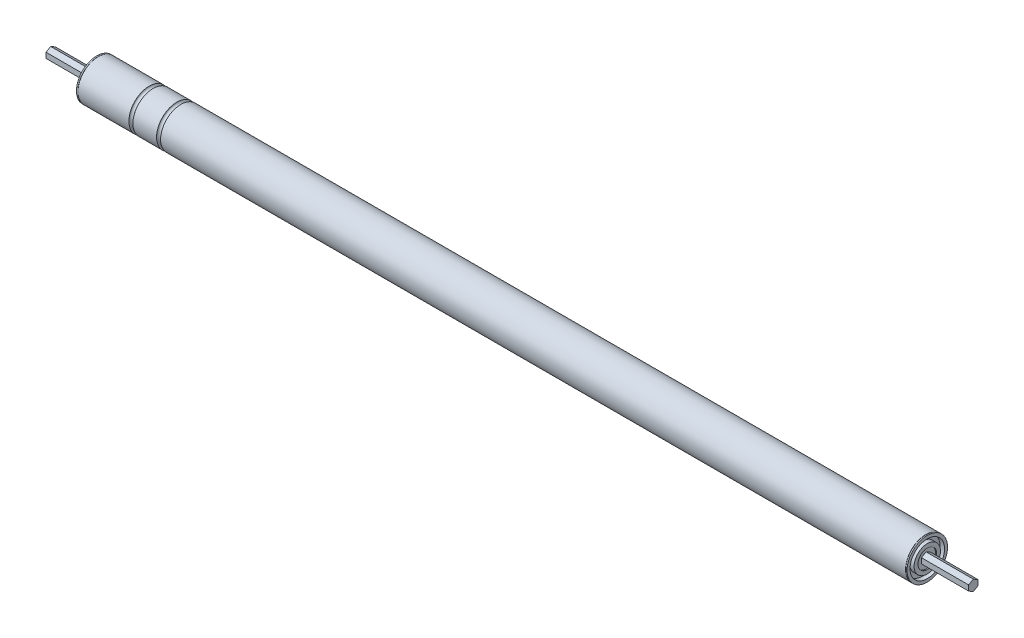
from build123d import *

# Parameters (mm, degrees)
BOSS_EXTRUDE1_START             = -487.984875
SKETCH3_R                       = 24.13
BOSS_EXTRUDE1_DEPTH             = 975.96975
CHAMFER1_SIZE                   = 0.254
BOSS_EXTRUDE3_REACH             = 985.674
SKETCH6_R                       = 24.13
SKETCH6_R_2                     = 22.352
BOSS_EXTRUDE3_DIRECTION_2_REACH = 985.674
BOSS_EXTRUDE2_DEPTH             = 508
BOSS_EXTRUDE2_DEPTH_BACK        = 508
LPATTERN1_COUNT                 = 2
LPATTERN1_PITCH                 = 33.02
BOSS_EXTRUDE4_DEPTH             = 550
BOSS_EXTRUDE5_DEPTH             = 550


with BuildPart() as part:
    # Sketch2 → Revolve1 (revolve)
    with BuildSketch(Plane.XY, mode=Mode.PRIVATE) as revolve1_sk:
        Polygon((-493.7125, 0), (-493.7125, 11.1125), (-495.096875, 11.1125), (-495.096875, 15.712927565), (-489.762875, 15.712927565), (-489.762875, 20.574), (-495.096875, 20.574), (-495.096875, 24.13), (-493.318875, 24.13), (-493.318875, 22.352), (-487.984875, 22.352), (-487.984875, 0), align=None)
    revolve(revolve1_sk.sketch.rotate(Axis((-493.7125, 0, 0), (1, 0, 0)), 180), axis=Axis((-493.7125, 0, 0), (1, 0, 0)))


with BuildPart() as body_2:
    # Mirror2: mirrored copy
    add(part.part.mirror(Plane(origin=(0, 0, 0), x_dir=(0, 0, 1), z_dir=(1, 0, 0))))


with BuildPart() as part_1:
    add(part.part)

    add(body_2.part)  # Boss-Extrude1 merges body 2
    # Sketch3 → Boss-Extrude1 (add)
    with BuildSketch(Plane(origin=(0, 0, 0), x_dir=(0, 0, -1), z_dir=(1, 0, 0)).offset(BOSS_EXTRUDE1_START)):
        with Locations(Location((0, 0, 0), (0, 0, 270))):
            Circle(SKETCH3_R)
    extrude(amount=BOSS_EXTRUDE1_DEPTH)

    # Chamfer1
    chamfer1_edges = [part_1.edges().sort_by_distance(p)[0] for p in [
        (493.318875, 24.13, 0),
        (-493.318875, 24.13, 0),
    ]]
    chamfer(chamfer1_edges, length=CHAMFER1_SIZE)

    # Boss-Extrude3: up to this face of the body (flat: up to its plane)
    boss_extrude3_end = Plane(part_1.part.faces().sort_by_distance((-493.318875, 23.20068474, 0))[0])
    # Sketch6 → Boss-Extrude3 (add, up to the picked face)
    with BuildSketch(Plane.ZY.offset(487.984875), mode=Mode.PRIVATE) as boss_extrude3_sk1:
        with Locations(Location((0, 0, 0), (0, 0, 270))):
            Circle(SKETCH6_R)
        Circle(SKETCH6_R_2, mode=Mode.SUBTRACT)
    boss_extrude3_tool1 = split(extrude(boss_extrude3_sk1.sketch, amount=BOSS_EXTRUDE3_REACH, mode=Mode.PRIVATE), bisect_by=boss_extrude3_end, keep=Keep.BOTH, mode=Mode.PRIVATE)
    add(boss_extrude3_tool1.solids().sort_by(Axis((-487.984875, 23.447501, 0), (-1, 0, 0)))[0])

    # Boss-Extrude3 direction 2: up to this face of the body (flat: up to its plane)
    boss_extrude3_direction_2_end = Plane(part_1.part.faces().sort_by_distance((493.318875, 23.20068474, 0))[0])
    # Sketch6 → Boss-Extrude3 direction 2 (add, up to the picked face)
    with BuildSketch(Plane.ZY.offset(487.984875), mode=Mode.PRIVATE) as boss_extrude3_direction_2_sk1:
        with Locations(Location((0, 0, 0), (0, 0, 270))):
            Circle(SKETCH6_R)
        Circle(SKETCH6_R_2, mode=Mode.SUBTRACT)
    boss_extrude3_direction_2_tool1 = split(extrude(boss_extrude3_direction_2_sk1.sketch, amount=-BOSS_EXTRUDE3_DIRECTION_2_REACH, mode=Mode.PRIVATE), bisect_by=boss_extrude3_direction_2_end, keep=Keep.BOTH, mode=Mode.PRIVATE)
    add(boss_extrude3_direction_2_tool1.solids().sort_by(Axis((-487.984875, 23.447501, 0), (1, 0, 0)))[0])

    # Sketch4 → Boss-Extrude2 (add, two sides: drawn at the far end of the back side and taken through both)
    with BuildSketch(Plane(origin=(0, 0, 0), x_dir=(0, 0, -1), z_dir=(1, 0, 0)).offset(-BOSS_EXTRUDE2_DEPTH_BACK)):
        Polygon((0, 6.415804866), (-5.55625, 3.207902433), (-5.55625, -3.207902433), (0, -6.415804866), (5.55625, -3.207902433), (5.55625, 3.207902433), align=None)
    extrude(amount=BOSS_EXTRUDE2_DEPTH + BOSS_EXTRUDE2_DEPTH_BACK)

    # Sketch5 → Cut-Revolve1 (revolve, cut)
    with BuildSketch(Plane.XY, mode=Mode.PRIVATE) as cut_revolve1_sk:
        with BuildLine():
            Line((-433.38115, 24.8874), (-433.38115, 25.5224))
            Line((-433.38115, 25.5224), (-427.04385, 25.5224))
            Line((-427.04385, 25.5224), (-427.04385, 24.8874))
            ThreePointArc((-427.04385, 24.8874), (-427.60062588, 24.65677588), (-427.83125, 24.1))
            ThreePointArc((-427.83125, 24.1), (-430.2125, 21.71875), (-432.59375, 24.1))
            ThreePointArc((-432.59375, 24.1), (-432.82437412, 24.65677588), (-433.38115, 24.8874))
        make_face()
    cut_revolve1 = revolve(cut_revolve1_sk.sketch.rotate(Axis((-508, 0, 0), (1, 0, 0)), 180), axis=Axis((-508, 0, 0), (1, 0, 0)), mode=Mode.SUBTRACT)

    # LPattern1: Cut-Revolve1 ×2
    with Locations(*[(i * LPATTERN1_PITCH, 0, 0) for i in range(1, LPATTERN1_COUNT)]):
        add(cut_revolve1, mode=Mode.SUBTRACT)

    # Sketch4<2> → Boss-Extrude4 (add)
    with BuildSketch(Plane(origin=(0, 0, 0), x_dir=(0, 0, -1), z_dir=(1, 0, 0))):
        Polygon((0, 6.415804866), (-5.55625, 3.207902433), (-5.55625, -3.207902433), (0, -6.415804866), (5.55625, -3.207902433), (5.55625, 3.207902433), align=None)
    extrude(amount=BOSS_EXTRUDE4_DEPTH)

    # Sketch4<3> → Boss-Extrude5 (add)
    with BuildSketch(Plane(origin=(0, 0, 0), x_dir=(0, 0, -1), z_dir=(1, 0, 0))):
        Polygon((0, 6.415804866), (-5.55625, 3.207902433), (-5.55625, -3.207902433), (0, -6.415804866), (5.55625, -3.207902433), (5.55625, 3.207902433), align=None)
    extrude(amount=-BOSS_EXTRUDE5_DEPTH)


solid = part_1.part
